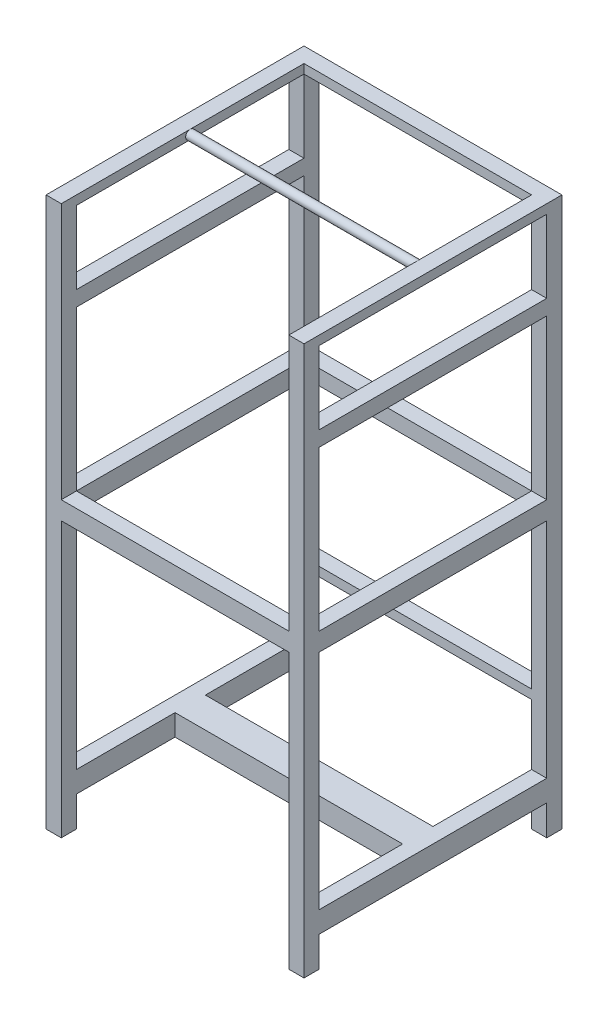
from build123d import *

# Parameters (mm, degrees)
SKETCH1_W             = 50
SKETCH1_H             = 50
BOSS_EXTRUDE1_DEPTH   = 1810
BOSS_EXTRUDE1_2_DEPTH = 1810
BOSS_EXTRUDE1_3_DEPTH = 1810
BOSS_EXTRUDE1_4_DEPTH = 1810
BOSS_EXTRUDE2_START   = 10
SKETCH2_W             = 50
SKETCH2_H             = 750
SKETCH2_W_2           = 750
SKETCH2_H_2           = 100
BOSS_EXTRUDE2_DEPTH   = 180
SKETCH4_W             = 750
SKETCH4_H             = 110
CUT_EXTRUDE4_DEPTH    = 1050
SKETCH5_W             = 50
SKETCH5_H             = 50
SKETCH5_H_2           = 60
BOSS_EXTRUDE3_DEPTH   = 770
SKETCH6_W             = 50
SKETCH6_H             = 60
BOSS_EXTRUDE4_DEPTH   = 770
SKETCH8_W             = 50
SKETCH8_H             = 50
BOSS_EXTRUDE5_DEPTH   = 770
SKETCH9_W             = 50
SKETCH9_H             = 30
BOSS_EXTRUDE6_DEPTH   = 770
SKETCH10_R            = 15
BOSS_EXTRUDE7_DEPTH   = 770
SKETCH11_W            = 50
SKETCH11_H            = 30
BOSS_EXTRUDE8_DEPTH   = 770
SKETCH12_W            = 50
SKETCH12_H            = 30
BOSS_EXTRUDE9_DEPTH   = 770


with BuildPart() as part:
    # Sketch1 → Boss-Extrude1 (new body)
    with BuildSketch(Plane(origin=(0, 0, 0), x_dir=(1, 0, 0), z_dir=(0, 1, 0))):
        with Locations((-427.760736196, -623.312883436)):
            Rectangle(SKETCH1_W, SKETCH1_H)
    extrude(amount=BOSS_EXTRUDE1_DEPTH)



with BuildPart() as body_2:
    # Sketch1 → Boss-Extrude1 2 (new body)
    with BuildSketch(Plane(origin=(0, 0, 0), x_dir=(1, 0, 0), z_dir=(0, 1, 0))):
        with Locations((372.239263804, -623.312883436)):
            Rectangle(SKETCH1_W, SKETCH1_H)
    extrude(amount=BOSS_EXTRUDE1_2_DEPTH)


with BuildPart() as body_3:
    # Sketch1 → Boss-Extrude1 3 (new body)
    with BuildSketch(Plane(origin=(0, 0, 0), x_dir=(1, 0, 0), z_dir=(0, 1, 0))):
        with Locations((372.239263804, 176.687116564)):
            Rectangle(SKETCH1_W, SKETCH1_H)
    extrude(amount=BOSS_EXTRUDE1_3_DEPTH)


with BuildPart() as body_4:
    # Sketch1 → Boss-Extrude1 4 (new body)
    with BuildSketch(Plane(origin=(0, 0, 0), x_dir=(1, 0, 0), z_dir=(0, 1, 0))):
        with Locations((-427.760736196, 176.687116564)):
            Rectangle(SKETCH1_W, SKETCH1_H)
    extrude(amount=BOSS_EXTRUDE1_4_DEPTH)


with BuildPart() as part_1:
    add(part.part)

    add(body_2.part)  # Boss-Extrude2 merges body 2

    add(body_3.part)  # Boss-Extrude2 merges body 3

    add(body_4.part)  # Boss-Extrude2 merges body 4
    # Sketch2 → Boss-Extrude2 (add)
    with BuildSketch(Plane(origin=(0, 0, 0), x_dir=(-1, 0, 0), z_dir=(0, -1, 0)).offset(BOSS_EXTRUDE2_START)):
        with Locations((427.760736196, -223.312883436)):
            Rectangle(SKETCH2_W, SKETCH2_H)
        with Locations((27.760736196, -223.312883436)):
            Rectangle(SKETCH2_W_2, SKETCH2_H_2)
        with Locations((-372.239263804, -223.312883436)):
            Rectangle(SKETCH2_W, SKETCH2_H)
    extrude(amount=-BOSS_EXTRUDE2_DEPTH)

    # Sketch4 → Cut-Extrude4 (cut)
    with BuildSketch(Plane.ZY.offset(452.760736196)):
        with Locations((223.312883436, 45)):
            Rectangle(SKETCH4_W, SKETCH4_H)
    extrude(amount=-CUT_EXTRUDE4_DEPTH, mode=Mode.SUBTRACT)

    # Sketch5 → Boss-Extrude3 (add)
    with BuildSketch(Plane.ZY.offset(-347.239263804)):
        with Locations((-176.687116564, 940)):
            Rectangle(SKETCH5_W, SKETCH5_H)
        with Locations((623.312883436, 935)):
            Rectangle(SKETCH5_W, SKETCH5_H_2)
    extrude(amount=BOSS_EXTRUDE3_DEPTH)

    # Sketch6 → Boss-Extrude4 (add)
    with BuildSketch(Plane(origin=(0, 0, 598.312883436), x_dir=(-1, 0, 0), z_dir=(0, 0, -1))):
        with Locations((-372.239263804, 935)):
            Rectangle(SKETCH6_W, SKETCH6_H)
        with Locations((427.760736196, 935)):
            Rectangle(SKETCH6_W, SKETCH6_H)
    extrude(amount=BOSS_EXTRUDE4_DEPTH)

    # Sketch8 → Boss-Extrude5 (add)
    with BuildSketch(Plane(origin=(0, 0, 598.312883436), x_dir=(-1, 0, 0), z_dir=(0, 0, -1))):
        with Locations((-372.239263804, 1514.740067664)):
            Rectangle(SKETCH8_W, SKETCH8_H)
        with Locations((427.760736196, 1514.740067664)):
            Rectangle(SKETCH8_W, SKETCH8_H)
    extrude(amount=BOSS_EXTRUDE5_DEPTH)

    # Sketch9 → Boss-Extrude6 (add)
    with BuildSketch(Plane.XY.offset(-151.687116564)):
        with Locations((-427.760736196, 1795)):
            Rectangle(SKETCH9_W, SKETCH9_H)
        with Locations((372.239263804, 1795)):
            Rectangle(SKETCH9_W, SKETCH9_H)
    extrude(amount=BOSS_EXTRUDE6_DEPTH)

    # Sketch10 → Boss-Extrude7 (add)
    with BuildSketch(Plane(origin=(-402.760736196, 0, 0), x_dir=(0, 0, -1), z_dir=(1, 0, 0))):
        with Locations(Location((-223.312883436, 1795, 0), (0, 0, 270))):
            Circle(SKETCH10_R)
    extrude(amount=BOSS_EXTRUDE7_DEPTH)

    # Sketch11 → Boss-Extrude8 (add)
    with BuildSketch(Plane.ZY.offset(-347.239263804)):
        with Locations((-176.687116564, 1795)):
            Rectangle(SKETCH11_W, SKETCH11_H)
    extrude(amount=BOSS_EXTRUDE8_DEPTH)

    # Sketch12 → Boss-Extrude9 (add)
    with BuildSketch(Plane.ZY.offset(-347.239263804)):
        with Locations((-176.687116564, 384.816862376)):
            Rectangle(SKETCH12_W, SKETCH12_H)
    extrude(amount=BOSS_EXTRUDE9_DEPTH)


solid = part_1.part
